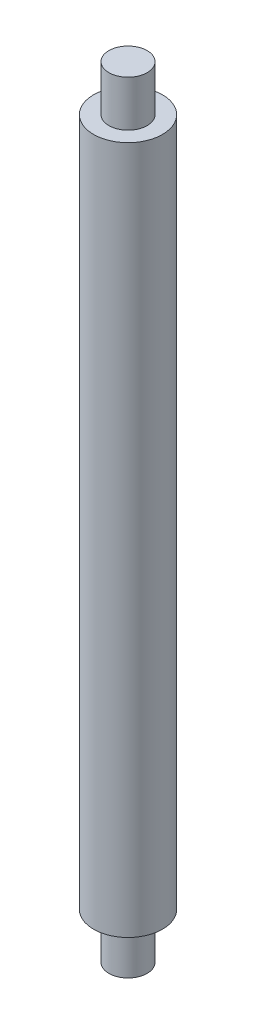
from build123d import *

# Parameters (mm, degrees)
SKETCH1_R           = 2.5
BOSS_EXTRUDE1_DEPTH = 6
SKETCH2_R           = 4.5
BOSS_EXTRUDE2_DEPTH = 90
SKETCH3_R           = 2.5
BOSS_EXTRUDE3_DEPTH = 6


with BuildPart() as part:
    # Sketch1 → Boss-Extrude1 (new body)
    with BuildSketch(Plane(origin=(0, 0, 0), x_dir=(1, 0, 0), z_dir=(0, 1, 0))):
        with Locations(Location((0, 0, 0), (0, 0, 270))):
            Circle(SKETCH1_R)
    extrude(amount=BOSS_EXTRUDE1_DEPTH)

    # Sketch2 → Boss-Extrude2 (add)
    with BuildSketch(Plane(origin=(0, 6, 0), x_dir=(1, 0, 0), z_dir=(0, 1, 0))):
        with Locations(Location((0, 0, 0), (0, 0, 90))):
            Circle(SKETCH2_R)
    extrude(amount=BOSS_EXTRUDE2_DEPTH)

    # Sketch3 → Boss-Extrude3 (add)
    with BuildSketch(Plane(origin=(0, 96, 0), x_dir=(1, 0, 0), z_dir=(0, 1, 0))):
        with Locations(Location((0, 0, 0), (0, 0, 270))):
            Circle(SKETCH3_R)
    extrude(amount=BOSS_EXTRUDE3_DEPTH)


solid = part.part
